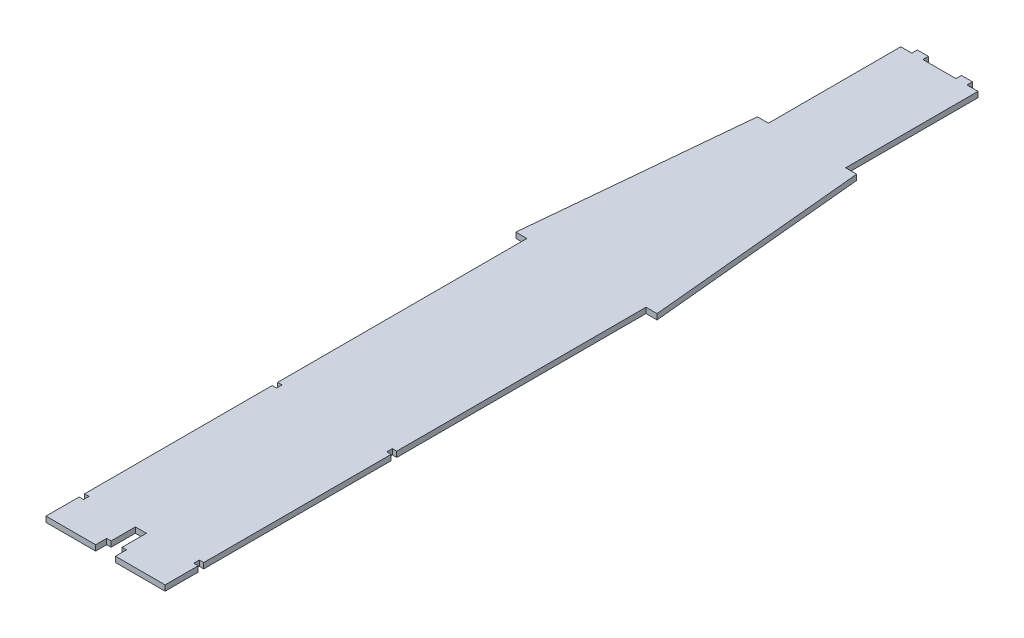
from build123d import *

# Parameters (mm, degrees)
SKETCH1_W           = 34.29
SKETCH1_H           = 276.86
SKETCH1_W_2         = 6.35
SKETCH1_H_2         = 3.175
BOSS_EXTRUDE1_DEPTH = 3.175
SKETCH3_W           = 2.54
SKETCH3_H           = 3.175
CUT_EXTRUDE1_DEPTH  = 490.020092379
SKETCH4_W           = 2.54
SKETCH4_H           = 6.35
SKETCH4_W_2         = 3.175
SKETCH4_H_2         = 13.97
CUT_EXTRUDE2_DEPTH  = 490.020092379


with BuildPart() as part:
    # Sketch1 → Boss-Extrude1 (new body)
    with BuildSketch(Plane(origin=(0, 0, 0), x_dir=(1, 0, 0), z_dir=(0, 1, 0))):
        with Locations((17.145, 138.43)):
            Rectangle(SKETCH1_W, SKETCH1_H)
        with Locations((51.435, 138.43)):
            Rectangle(SKETCH1_W, SKETCH1_H)
        Polygon((34.29, 403.86), (34.29, 276.86), (68.58, 276.86), (74.93, 276.86), (62.865, 403.86), (56.515, 403.86), align=None)
        Polygon((-6.35, 276.86), (0, 276.86), (34.29, 276.86), (34.29, 403.86), (12.065, 403.86), (5.715, 403.86), align=None)
        Polygon((12.065, 403.86), (34.29, 403.86), (56.515, 403.86), (56.515, 480.06), (50.165, 480.06), (43.815, 480.06), (24.765, 480.06), (18.415, 480.06), (12.065, 480.06), align=None)
        with Locations((21.59, 481.6475)):
            Rectangle(SKETCH1_W_2, SKETCH1_H_2)
        with Locations((46.99, 481.6475)):
            Rectangle(SKETCH1_W_2, SKETCH1_H_2)
    extrude(amount=BOSS_EXTRUDE1_DEPTH)

    # Sketch3 → Cut-Extrude1 (cut, through all)
    with BuildSketch(Plane(origin=(0, 3.175, 0), x_dir=(1, 0, 0), z_dir=(0, 1, 0))):
        with Locations((1.27, 20.6375)):
            Rectangle(SKETCH3_W, SKETCH3_H)
        with Locations((67.31, 20.6375)):
            Rectangle(SKETCH3_W, SKETCH3_H)
        with Locations((1.27, 131.7625)):
            Rectangle(SKETCH3_W, SKETCH3_H)
        with Locations((67.31, 131.7625)):
            Rectangle(SKETCH3_W, SKETCH3_H)
    extrude(amount=-CUT_EXTRUDE1_DEPTH, mode=Mode.SUBTRACT)

    # Sketch4 → Cut-Extrude2 (cut, through all)
    with BuildSketch(Plane(origin=(0, 3.175, 0), x_dir=(1, 0, 0), z_dir=(0, 1, 0))):
        with Locations((29.845, 3.175)):
            Rectangle(SKETCH4_W, SKETCH4_H)
        with Locations((32.7025, 3.175)):
            Rectangle(SKETCH4_W_2, SKETCH4_H)
        with Locations((35.8775, 3.175)):
            Rectangle(SKETCH4_W_2, SKETCH4_H)
        with Locations((38.735, 3.175)):
            Rectangle(SKETCH4_W, SKETCH4_H)
        with Locations((35.8775, 13.335)):
            Rectangle(SKETCH4_W_2, SKETCH4_H_2)
        with Locations((32.7025, 13.335)):
            Rectangle(SKETCH4_W_2, SKETCH4_H_2)
    extrude(amount=-CUT_EXTRUDE2_DEPTH, mode=Mode.SUBTRACT)


solid = part.part
